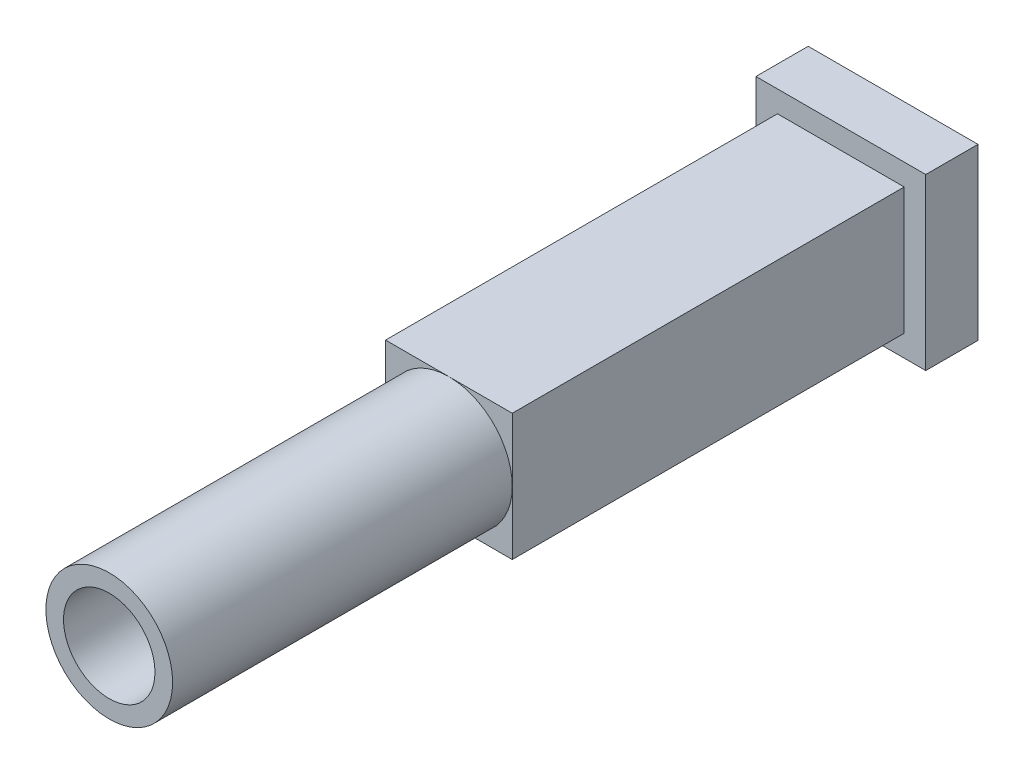
from build123d import *

# Parameters (mm, degrees)
SKETCH1_W           = 9.7
SKETCH1_H           = 9.7
BOSS_EXTRUDE1_DEPTH = 30
SKETCH2_R           = 4.85
BOSS_EXTRUDE2_DEPTH = 26
SKETCH3_W           = 13
SKETCH3_H           = 13
BOSS_EXTRUDE3_DEPTH = 4
SKETCH4_R           = 3.5
CUT_EXTRUDE1_DEPTH  = 10


with BuildPart() as part:
    # Sketch1 → Boss-Extrude1 (new body)
    with BuildSketch(Plane.XY):
        with Locations((4.85, -4.85)):
            Rectangle(SKETCH1_W, SKETCH1_H)
    extrude(amount=BOSS_EXTRUDE1_DEPTH)

    # Sketch2 → Boss-Extrude2 (add)
    with BuildSketch(Plane.XY.offset(30)):
        with Locations((4.85, -4.85)):
            Circle(SKETCH2_R)
    extrude(amount=BOSS_EXTRUDE2_DEPTH)

    # Sketch3 → Boss-Extrude3 (add)
    with BuildSketch(Plane(origin=(0, 0, 0), x_dir=(-1, 0, 0), z_dir=(0, 0, -1))):
        with Locations((-4.85, -4.85)):
            Rectangle(SKETCH3_W, SKETCH3_H)
    extrude(amount=BOSS_EXTRUDE3_DEPTH)

    # Sketch4 → Cut-Extrude1 (cut)
    with BuildSketch(Plane.XY.offset(56)):
        with Locations((4.85, -4.85)):
            Circle(SKETCH4_R)
    extrude(amount=-CUT_EXTRUDE1_DEPTH, mode=Mode.SUBTRACT)


solid = part.part
